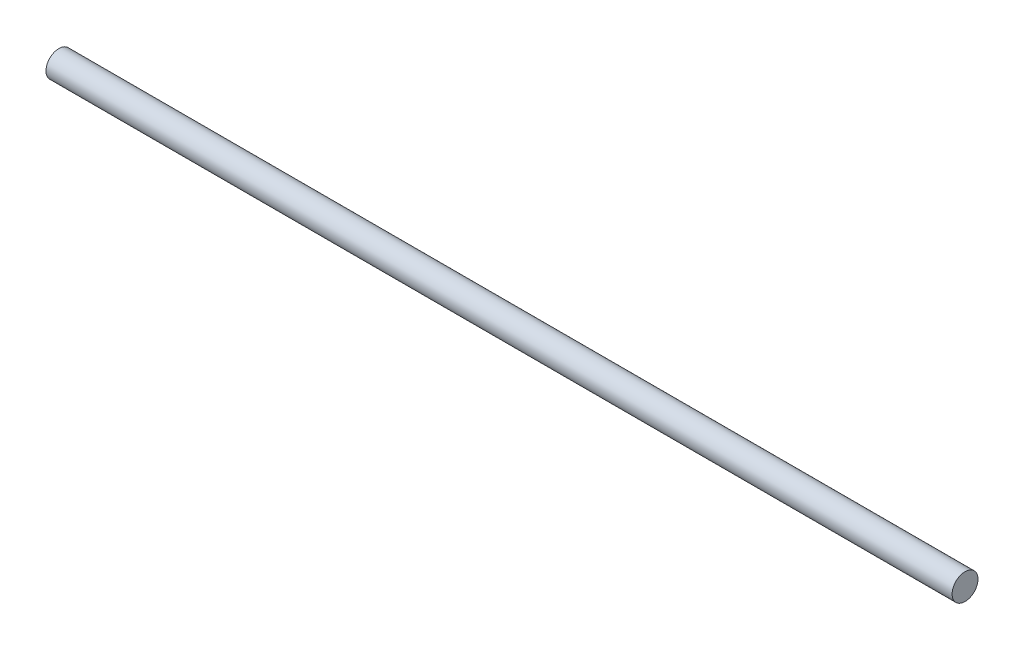
from build123d import *

# Parameters (mm, degrees)
SKETCH_1_R      = 2.429302192
EXTRUDE_1_DEPTH = 170


with BuildPart() as part:
    # 草图1 → 凸台-拉伸1 (new body)
    with BuildSketch(Plane(origin=(0, 0, 0), x_dir=(0, 0, -1), z_dir=(1, 0, 0))):
        with Locations((-8.754966743, 16.652729458)):
            Circle(SKETCH_1_R)
    extrude(amount=EXTRUDE_1_DEPTH)


solid = part.part
